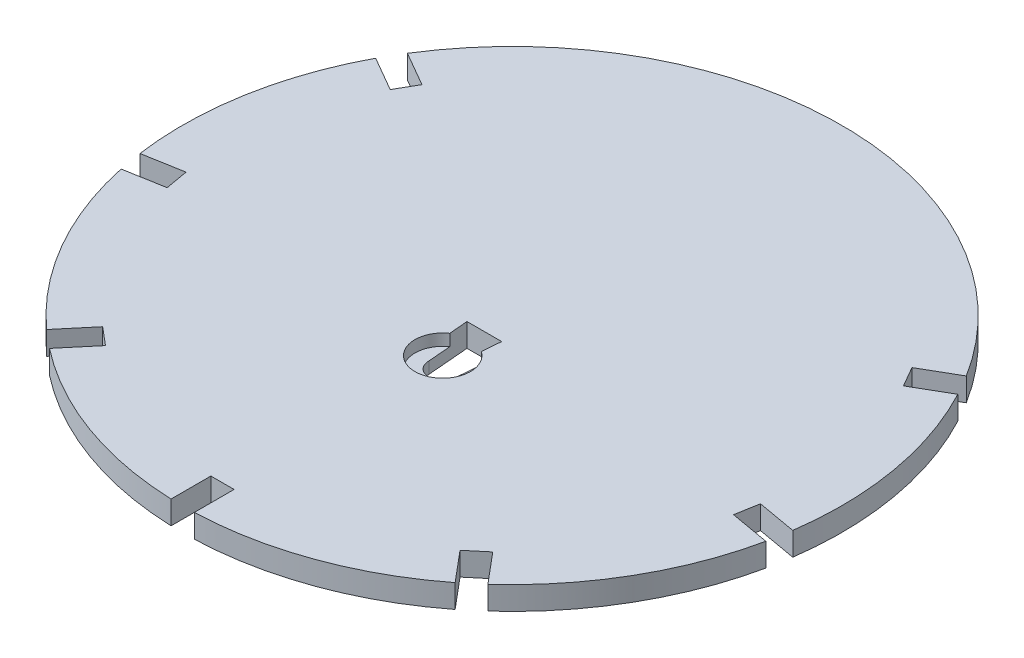
from build123d import *

# Parameters (mm, degrees)
SKETCH1_R           = 95
BOSS_EXTRUDE1_DEPTH = 6.7
SKETCH2_W           = 6.7
SKETCH2_H           = 20
CUT_EXTRUDE3_DEPTH  = 6.7
SKETCH3_R           = 8
CUT_EXTRUDE4_DEPTH  = 3.35


with BuildPart() as part:
    # Sketch1 → Boss-Extrude1 (new body)
    with BuildSketch(Plane(origin=(0, 0, 0), x_dir=(1, 0, 0), z_dir=(0, 1, 0))):
        with Locations(Location((0, 0, 0), (0, 0, 270))):
            Circle(SKETCH1_R)
    extrude(amount=BOSS_EXTRUDE1_DEPTH)

    # Sketch2 → Cut-Extrude3 (cut)
    with BuildSketch(Plane(origin=(0, 6.7, 0), x_dir=(1, 0, 0), z_dir=(0, 1, 0))):
        with BuildLine():
            Line((5, -8), (-5, -8))
            Line((-5, -8), (-4, -20))
            ThreePointArc((-4, -20), (0, -24), (4, -20))
            Line((4, -20), (5, -8))
        make_face()
        Polygon((87.936978657, 54.638685103), (70.616470581, 44.638685103), (73.966470581, 38.836314897), (91.286978657, 48.836314897), align=None)
        Polygon((69.078696797, -77.113110259), (56.222944603, -61.792221397), (51.090446834, -66.098898382), (63.946199028, -81.419787244), align=None)
        Polygon((102.484703638, -14.669139211), (82.788548578, -11.196175658), (81.625105788, -17.794387603), (101.321260848, -21.267351157), align=None)
        with Locations((0, -93.475)):
            Rectangle(SKETCH2_W, SKETCH2_H)
        Polygon((-63.946199028, -81.419787244), (-51.090446834, -66.098898382), (-56.222944603, -61.792221397), (-69.078696797, -77.113110259), align=None)
        Polygon((-101.321260848, -21.267351157), (-81.625105788, -17.794387603), (-82.788548578, -11.196175658), (-102.484703638, -14.669139211), align=None)
        Polygon((-91.286978657, 48.836314897), (-73.966470581, 38.836314897), (-70.616470581, 44.638685103), (-87.936978657, 54.638685103), align=None)
    extrude(amount=-CUT_EXTRUDE3_DEPTH, mode=Mode.SUBTRACT)

    # Sketch3 → Cut-Extrude4 (cut)
    with BuildSketch(Plane(origin=(0, 6.7, 0), x_dir=(1, 0, 0), z_dir=(0, 1, 0))):
        with Locations((0, -20)):
            Circle(SKETCH3_R)
    extrude(amount=-CUT_EXTRUDE4_DEPTH, mode=Mode.SUBTRACT)


solid = part.part
